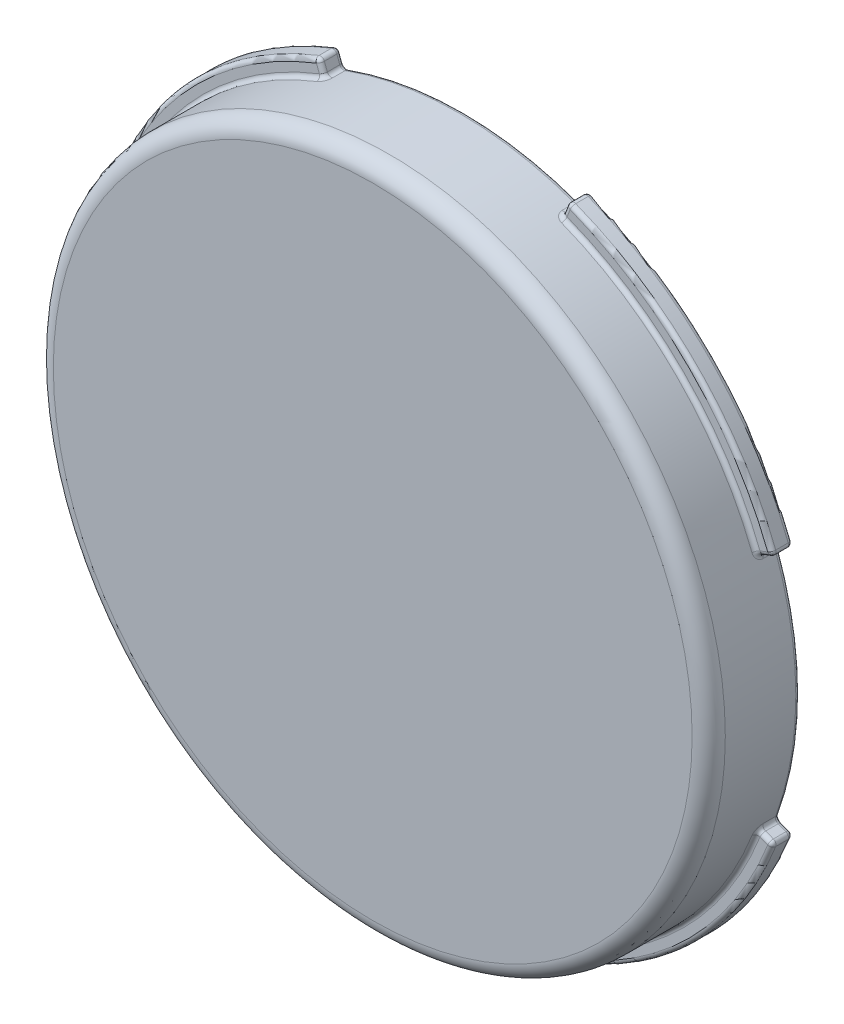
from build123d import *

# Parameters (mm, degrees)
SKETCH1_R           = 51.435
BOSS_EXTRUDE1_DEPTH = 13.97
FILLET1_R           = 2.54
SHELL1_T            = -2.8575
BOSS_EXTRUDE2_DEPTH = 3.175
FILLET2_R           = 0.635


with BuildPart() as part:
    # Sketch1 → Boss-Extrude1 (new body)
    with BuildSketch(Plane.XY):
        Circle(SKETCH1_R)
    extrude(amount=BOSS_EXTRUDE1_DEPTH)

    # Fillet1
    fillet1_edges = [part.edges().sort_by_distance(p)[0] for p in [
        (-51.435, 0, 13.97),
    ]]
    fillet(fillet1_edges, radius=FILLET1_R)

    # Shell1
    shell1_openings = [part.faces().sort_by_distance(p)[0] for p in [
        (0, 0, 0),
    ]]
    offset(amount=SHELL1_T, openings=shell1_openings, kind=Kind.INTERSECTION)

    # Sketch2 → Boss-Extrude2 (add)
    with BuildSketch(Plane(origin=(0, 0, 0), x_dir=(-1, 0, 0), z_dir=(0, 0, -1))):
        with BuildLine():
            Line((-19.05, 50.501466563), (-18.153529412, 48.12492696))
            ThreePointArc((-18.153529412, 48.12492696), (-36.37003729, 36.37003729), (-48.12492696, 18.153529412))
            Line((-48.12492696, 18.153529412), (-50.501466563, 19.05))
            ThreePointArc((-50.501466563, 19.05), (-38.166088515, 38.166088515), (-19.05, 50.501466563))
        make_face()
        with BuildLine():
            Line((18.153529412, 48.12492696), (19.05, 50.501466563))
            ThreePointArc((19.05, 50.501466563), (38.166088515, 38.166088515), (50.501466563, 19.05))
            Line((50.501466563, 19.05), (48.12492696, 18.153529412))
            ThreePointArc((48.12492696, 18.153529412), (36.37003729, 36.37003729), (18.153529412, 48.12492696))
        make_face()
        with BuildLine():
            Line((48.12492696, -18.153529412), (50.501466563, -19.05))
            ThreePointArc((50.501466563, -19.05), (38.166088515, -38.166088515), (19.05, -50.501466563))
            Line((19.05, -50.501466563), (18.153529412, -48.12492696))
            ThreePointArc((18.153529412, -48.12492696), (36.37003729, -36.37003729), (48.12492696, -18.153529412))
        make_face()
        with BuildLine():
            Line((-18.153529412, -48.12492696), (-19.05, -50.501466563))
            ThreePointArc((-19.05, -50.501466563), (-38.166088515, -38.166088515), (-50.501466563, -19.05))
            Line((-50.501466563, -19.05), (-48.12492696, -18.153529412))
            ThreePointArc((-48.12492696, -18.153529412), (-36.37003729, -36.37003729), (-18.153529412, -48.12492696))
        make_face()
    extrude(amount=-BOSS_EXTRUDE2_DEPTH)

    # Fillet2
    fillet2_edges = [part.edges().sort_by_distance(p)[0] for p in [
        (-51.435, 0, 0),
        (-36.37003729, 36.37003729, 3.175),
        (-48.12492696, 18.153529412, 1.5875),
        (-18.601764706, 49.313196761, 3.175),
        (-18.153529412, 48.12492696, 1.5875),
        (-38.166088515, 38.166088515, 3.175),
        (-19.05, 50.501466563, 1.5875),
        (-49.313196761, 18.601764706, 3.175),
        (-50.501466563, 19.05, 1.5875),
        (-49.313196761, 18.601764706, 0),
        (-38.166088515, 38.166088515, 0),
        (-18.601764706, 49.313196761, 0),
        (0, 51.435, 0),
        (38.166088515, 38.166088515, 3.175),
        (50.501466563, 19.05, 1.5875),
        (18.601764706, 49.313196761, 3.175),
        (19.05, 50.501466563, 1.5875),
        (36.37003729, 36.37003729, 3.175),
        (18.153529412, 48.12492696, 1.5875),
        (49.313196761, 18.601764706, 3.175),
        (48.12492696, 18.153529412, 1.5875),
        (38.166088515, 38.166088515, 0),
        (49.313196761, 18.601764706, 0),
        (18.601764706, 49.313196761, 0),
        (0, -51.435, 0),
        (-36.37003729, -36.37003729, 3.175),
        (-18.153529412, -48.12492696, 1.5875),
        (-49.313196761, -18.601764706, 3.175),
        (-48.12492696, -18.153529412, 1.5875),
        (-38.166088515, -38.166088515, 3.175),
        (-50.501466563, -19.05, 1.5875),
        (-18.601764706, -49.313196761, 3.175),
        (-19.05, -50.501466563, 1.5875),
        (-18.601764706, -49.313196761, 0),
        (-38.166088515, -38.166088515, 0),
        (-49.313196761, -18.601764706, 0),
        (50.600715623, -9.226418775, 0),
        (38.166088515, -38.166088515, 3.175),
        (19.05, -50.501466563, 1.5875),
        (49.313196761, -18.601764706, 3.175),
        (50.501466563, -19.05, 1.5875),
        (36.37003729, -36.37003729, 3.175),
        (48.12492696, -18.153529412, 1.5875),
        (18.601764706, -49.313196761, 3.175),
        (18.153529412, -48.12492696, 1.5875),
        (38.166088515, -38.166088515, 0),
        (18.601764706, -49.313196761, 0),
        (49.313196761, -18.601764706, 0),
        (-48.5775, 0, 0),
    ]]
    fillet(fillet2_edges, radius=FILLET2_R)


solid = part.part
